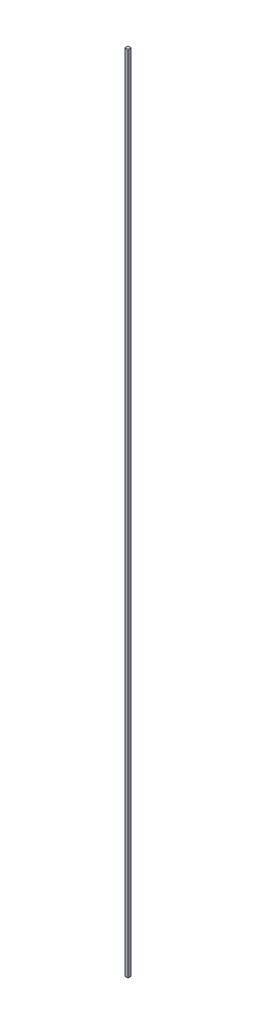
from build123d import *

# Parameters (mm, degrees)
SKETCH1_W           = 2
SKETCH1_H           = 2
BOSS_EXTRUDE1_DEPTH = 509.4


with BuildPart() as part:
    # Sketch1 → Boss-Extrude1 (new body)
    with BuildSketch(Plane(origin=(0, 0, 0), x_dir=(1, 0, 0), z_dir=(0, 1, 0))):
        with Locations((1, 1)):
            Rectangle(SKETCH1_W, SKETCH1_H)
    extrude(amount=BOSS_EXTRUDE1_DEPTH)


solid = part.part
